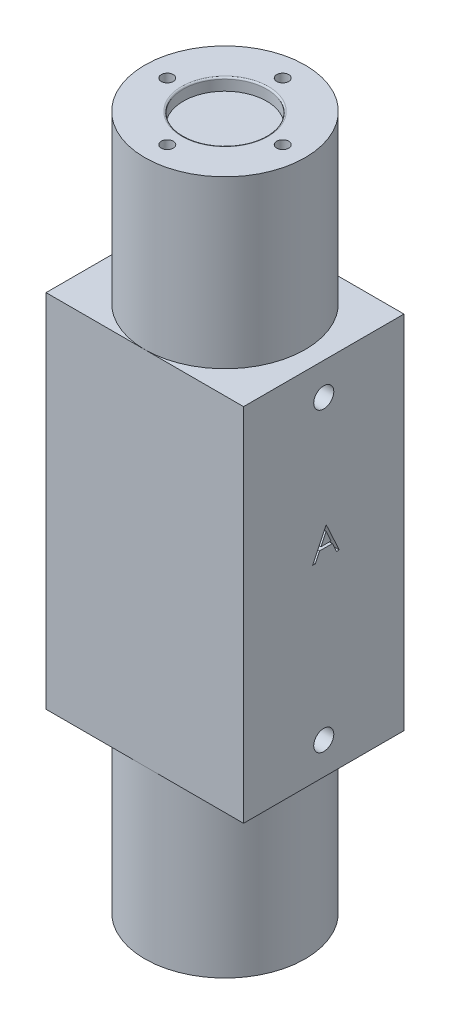
from build123d import *

# Parameters (mm, degrees)
FILLET1_R                 = 1
SKETCH2_R                 = 5.2
CUT_EXTRUDE1_DEPTH        = 1.5
FILLET2_R                 = 0.2
FILLET3_R                 = 5
CUT_EXTRUDE2_DEPTH        = 1
SKETCH6_R                 = 10
BOSS_EXTRUDE1_DEPTH       = 81.533333333
BOSS_EXTRUDE2_START       = 15.73
SKETCH8_W                 = 12.313661757
SKETCH8_H                 = 20
BOSS_EXTRUDE2_DEPTH       = 45
CUT_EXTRUDE5_DEPTH        = 2
CUT_EXTRUDE6_DEPTH        = 2
CUT_EXTRUDE_THIN1_START   = -10
SKETCH14_R                = 40
SKETCH14_R_2              = 10
CUT_EXTRUDE_THIN1_DEPTH   = 10
F_2_5MM_DOWEL_HOLE1_D     = 2.5
F_1_5MM_DOWEL_HOLE1_D     = 1.5
F_1_5MM_DOWEL_HOLE1_DEPTH = 12
F_1_5MM_DOWEL_HOLE1_TIP   = 0.450645464


with BuildPart() as part:
    # Sketch1 → Revolve1 (revolve)
    with BuildSketch(Plane(origin=(0, 0, 0), x_dir=(0, 0, -1), z_dir=(1, 0, 0))):
        Polygon((0, 0), (-30, 0), (-30, 7), (-20.102542457, 7), (-10.55, 7), (-10.55, 5), (0, 5), align=None)
    revolve(axis=Axis((0, 5, 0), (0, -1, 0)))

    # Fillet1
    fillet1_edges = [part.edges().sort_by_distance(p)[0] for p in [
        (0, 7, -10.55),
    ]]
    fillet(fillet1_edges, radius=FILLET1_R)

    # Sketch2 → Cut-Extrude1 (cut)
    with BuildSketch(Plane(origin=(0, 5, 0), x_dir=(1, 0, 0), z_dir=(0, 1, 0))):
        Circle(SKETCH2_R)
    extrude(amount=-CUT_EXTRUDE1_DEPTH, mode=Mode.SUBTRACT)

    # Fillet2
    fillet2_edges = [part.edges().sort_by_distance(p)[0] for p in [
        (-5.2, 5, 0),
    ]]
    fillet(fillet2_edges, radius=FILLET2_R)

    # Fillet3
    fillet3_edges = [part.edges().sort_by_distance(p)[0] for p in [
        (0, 7, -30),
    ]]
    fillet(fillet3_edges, radius=FILLET3_R)

    # Sketch4 → Cut-Extrude2 (cut)
    # profile 1 of 4: a face of its own
    with BuildSketch(Plane.XZ):
        Polygon((-0.644909543, 25.480704332), (0.002225874, 25.480704332), (0.002225874, 21.980704332), (-0.31187669, 21.980704332), (-0.31187669, 25.121729973), (-0.850338229, 25.121729973), align=None)
    # profile 2 of 4: a face of its own
    with BuildSketch(Plane.XZ):
        with BuildLine():
            Line((25.523815675, 2.292498481), (25.209713111, 2.292498481))
            add(Edge.make_bspline(
                [(25.209713111, 2.292498481), (25.211760264, 2.334169369), (25.215780818, 2.416009884), (25.234609107, 2.53533379), (25.261549984, 2.649388589), (25.299641438, 2.757258503), (25.346947716, 2.85989731), (25.403677743, 2.956897326), (25.470871594, 3.047888515), (25.547078328, 3.132027358), (25.629846967, 3.209214929), (25.719152906, 3.275870171), (25.812997934, 3.332187843), (25.911097333, 3.379269085), (26.014557896, 3.414608931), (26.122440754, 3.44083057), (26.23521989, 3.456606916), (26.312059912, 3.458302702), (26.351139393, 3.459165148)],
                knots=[0, 0, 0, 0, 1.10065271, 2.161652631, 3.183658789, 4.190468796, 5.17591951, 6.163126047, 7.15150782, 8.156236427, 9.156009102, 10.134482811, 11.092018607, 12.041330605, 13.001268258, 13.972401359, 14.968799086, 16, 16, 16, 16], degree=3))
            add(Edge.make_bspline(
                [(26.351139393, 3.459165148), (26.389517467, 3.458266692), (26.464929011, 3.456501257), (26.574991026, 3.441340228), (26.67976832, 3.417594636), (26.779056087, 3.38427922), (26.872062151, 3.339494792), (26.959485196, 3.285697254), (27.042366007, 3.223477422), (27.11697279, 3.150223609), (27.18548087, 3.072021224), (27.244583125, 2.988533321), (27.295196288, 2.902304035), (27.337383968, 2.812675833), (27.368440107, 2.718804805), (27.392018315, 2.622057602), (27.405345729, 2.521432791), (27.407391152, 2.453326236), (27.408431059, 2.418700405)],
                knots=[0, 0, 0, 0, 1.111607364, 2.184268762, 3.212621178, 4.221274766, 5.211760367, 6.196651075, 7.1921475, 8.207485113, 9.220403448, 10.201281604, 11.166441695, 12.114753415, 13.065576456, 14.026450734, 14.996634279, 16, 16, 16, 16], degree=3))
            add(Edge.make_bspline(
                [(27.408431059, 2.418700405), (27.406744414, 2.369950595), (27.403400723, 2.273306467), (27.37454502, 2.13110211), (27.329962923, 1.99319705), (27.275889894, 1.882217998), (27.221269326, 1.793241105), (27.17308953, 1.719325464), (27.115437178, 1.640499047), (27.048839764, 1.555967938), (26.974301958, 1.465473568), (26.89128729, 1.368978802), (26.7991616, 1.267508497), (26.734503418, 1.198202684), (26.700999168, 1.162290148)],
                knots=[0, 0, 0, 0, 1.184203166, 2.347625244, 3.513805382, 4.700623107, 5.337941753, 6.051866363, 6.845199593, 7.711357327, 8.668078039, 9.695487809, 10.805859518, 12, 12, 12, 12], degree=3))
            Line((26.700999168, 1.162290148), (25.825298046, 0.228395917))
            Line((25.825298046, 0.228395917), (27.453302854, 0.228395917))
            Line((27.453302854, 0.228395917), (27.453302854, -0.130578442))
            Line((27.453302854, -0.130578442), (25.075097726, -0.130578442))
            Line((25.075097726, -0.130578442), (26.432469521, 1.317939187))
            add(Edge.make_bspline(
                [(26.432469521, 1.317939187), (26.465517408, 1.352437493), (26.528995635, 1.41870168), (26.618778212, 1.51544464), (26.6994172, 1.605194181), (26.771434593, 1.687780729), (26.833268098, 1.764412297), (26.88814033, 1.832607), (26.932105921, 1.895361451), (26.979821317, 1.968102065), (27.026035298, 2.056914382), (27.065747654, 2.165448071), (27.089962502, 2.277175324), (27.092867338, 2.352677361), (27.094328495, 2.390655533)],
                knots=[0, 0, 0, 0, 1.329631726, 2.553950428, 3.673215718, 4.687767853, 5.603093632, 6.413772471, 7.123043292, 7.734684054, 8.834405432, 9.900288307, 10.943827018, 12, 12, 12, 12], degree=3))
            add(Edge.make_bspline(
                [(27.094328495, 2.390655533), (27.093692753, 2.414536931), (27.092439827, 2.461602582), (27.081382129, 2.530608341), (27.064671623, 2.597173154), (27.040726365, 2.661501774), (27.009119625, 2.722947426), (26.970646245, 2.781584906), (26.926256182, 2.838273871), (26.874904912, 2.891427169), (26.818493393, 2.940108375), (26.758899143, 2.98323246), (26.695849039, 3.019271571), (26.629608917, 3.048815068), (26.560363447, 3.071990449), (26.487978702, 3.088049029), (26.412654686, 3.098131512), (26.36122119, 3.099495684), (26.335013591, 3.100190789)],
                knots=[0, 0, 0, 0, 0.991446411, 1.95395049, 2.89581595, 3.838931463, 4.798493298, 5.75982156, 6.748411868, 7.785213223, 8.824556874, 9.840280684, 10.836137867, 11.835679398, 12.848801643, 13.863922112, 14.911575587, 16, 16, 16, 16], degree=3))
            add(Edge.make_bspline(
                [(26.335013591, 3.100190789), (26.307642759, 3.099475757), (26.253890962, 3.098071552), (26.174971929, 3.088248888), (26.099686152, 3.071303047), (26.027844249, 3.048126373), (25.959324663, 3.018667824), (25.894460619, 2.981976079), (25.83339773, 2.938192586), (25.776021206, 2.88855203), (25.723157227, 2.833284429), (25.676710352, 2.771674466), (25.636126337, 2.70484705), (25.600717104, 2.6329825), (25.571961414, 2.55542872), (25.549988263, 2.472461015), (25.532601417, 2.384439633), (25.526792896, 2.323654549), (25.523815675, 2.292498481)],
                knots=[0, 0, 0, 0, 1.031018746, 2.02475058, 2.990194455, 3.934040569, 4.864654155, 5.795059489, 6.735614925, 7.690564532, 8.649604399, 9.611025574, 10.590972636, 11.591080095, 12.624614302, 13.701020113, 14.821632451, 16, 16, 16, 16], degree=3))
        make_face()
    # profile 3 of 4: a face of its own
    with BuildSketch(Plane.XZ):
        with BuildLine():
            Line((0.191598009, -25.382057247), (-0.122504556, -25.382057247))
            add(Edge.make_bspline(
                [(-0.122504556, -25.382057247), (-0.113995005, -25.346824763), (-0.097359529, -25.277948138), (-0.062661956, -25.179540878), (-0.024862701, -25.086417356), (0.020526404, -25.000321283), (0.070035158, -24.91952238), (0.12675788, -24.845853255), (0.188077602, -24.77744029), (0.255902552, -24.716727052), (0.327031213, -24.661749323), (0.402465833, -24.614874266), (0.480688727, -24.574550113), (0.56224186, -24.541329881), (0.647368031, -24.516304357), (0.735297655, -24.498147552), (0.826261155, -24.486356438), (0.888008745, -24.485205674), (0.919362432, -24.484621349)],
                knots=[0, 0, 0, 0, 1.162005537, 2.271625781, 3.343758855, 4.383309926, 5.390229558, 6.379919256, 7.361854164, 8.333198761, 9.295911338, 10.242430842, 11.177959212, 12.116337295, 13.062827104, 14.020064771, 14.994644689, 16, 16, 16, 16], degree=3))
            add(Edge.make_bspline(
                [(0.919362432, -24.484621349), (0.965045174, -24.48600058), (1.055414185, -24.488728955), (1.188177232, -24.513643392), (1.316204051, -24.553068524), (1.438093299, -24.607542251), (1.551311731, -24.674729564), (1.652047918, -24.754694301), (1.738936429, -24.845893603), (1.811830806, -24.946626167), (1.868905805, -25.054281676), (1.910992179, -25.165081833), (1.93661386, -25.278763805), (1.939934417, -25.355521084), (1.941598009, -25.393976317)],
                knots=[0, 0, 0, 0, 1.083050992, 2.142477498, 3.193116406, 4.255571735, 5.30263384, 6.308962982, 7.297363603, 8.282367274, 9.249857812, 10.179914175, 11.08814088, 12, 12, 12, 12], degree=3))
            add(Edge.make_bspline(
                [(1.941598009, -25.393976317), (1.940434418, -25.430983112), (1.93815745, -25.503399667), (1.918823745, -25.609121164), (1.886287482, -25.708762764), (1.841217719, -25.802743926), (1.782876169, -25.890468766), (1.712203472, -25.972134657), (1.628700811, -26.048103815), (1.565421872, -26.091623288), (1.532844002, -26.114028401)],
                knots=[0, 0, 0, 0, 1.024540389, 2.004866551, 2.965041327, 3.920577974, 4.882998113, 5.874504559, 6.905732034, 8, 8, 8, 8], degree=3))
            add(Edge.make_bspline(
                [(1.532844002, -26.114028401), (1.570075757, -26.132006572), (1.643842631, -26.16762653), (1.744393161, -26.237482287), (1.835671036, -26.318138635), (1.886574755, -26.381081288), (1.912150893, -26.412706285)],
                knots=[0, 0, 0, 0, 1.015518401, 2.012035669, 3.001164323, 4, 4, 4, 4], degree=3))
            add(Edge.make_bspline(
                [(1.912150893, -26.412706285), (1.928992236, -26.435764037), (1.962399132, -26.481501953), (2.003634665, -26.555038379), (2.04104378, -26.629389869), (2.070193999, -26.706549275), (2.092767866, -26.785622288), (2.108903898, -26.866744684), (2.118928039, -26.949982707), (2.120363591, -27.006295187), (2.121085188, -27.034601317)],
                knots=[0, 0, 0, 0, 1.025084078, 2.033381695, 3.024893161, 4.013698104, 4.991890475, 5.976764909, 6.982997093, 8, 8, 8, 8], degree=3))
            add(Edge.make_bspline(
                [(2.121085188, -27.034601317), (2.119290675, -27.083611039), (2.115710093, -27.18139984), (2.083706018, -27.325874562), (2.034092778, -27.467100064), (1.963635842, -27.602174904), (1.877768333, -27.728555285), (1.775611009, -27.841631594), (1.6583246, -27.938830198), (1.527518951, -28.020040426), (1.385801823, -28.084958348), (1.234226231, -28.130015791), (1.074976177, -28.159361791), (0.965768879, -28.16250866), (0.910247848, -28.164108529)],
                knots=[0, 0, 0, 0, 0.955779014, 1.907060117, 2.875433937, 3.871313158, 4.872415639, 5.851225146, 6.836215519, 7.83643374, 8.849228613, 9.86973379, 10.916971861, 12, 12, 12, 12], degree=3))
            add(Edge.make_bspline(
                [(0.910247848, -28.164108529), (0.872828548, -28.163240316), (0.799199843, -28.161531961), (0.690956345, -28.14985336), (0.587634645, -28.128523355), (0.489095047, -28.09982005), (0.395250011, -28.063428308), (0.306385906, -28.01810961), (0.221956012, -27.964798108), (0.142757061, -27.90286452), (0.068798493, -27.83358318), (0.002045769, -27.75572417), (-0.058614024, -27.670726766), (-0.111556662, -27.57760371), (-0.159193615, -27.477558453), (-0.198374572, -27.369309954), (-0.23286014, -27.253825932), (-0.248893605, -27.173348192), (-0.25711994, -27.132057247)],
                knots=[0, 0, 0, 0, 1.048658725, 2.063410685, 3.046034179, 4.001477787, 4.936774919, 5.862367409, 6.792675028, 7.730719943, 8.675894397, 9.627829632, 10.600096036, 11.597688215, 12.626045268, 13.701542398, 14.82072376, 16, 16, 16, 16], degree=3))
            Line((-0.25711994, -27.132057247), (0.056982624, -27.132057247))
            add(Edge.make_bspline(
                [(0.056982624, -27.132057247), (0.065165915, -27.15900626), (0.081083128, -27.211424432), (0.108177426, -27.286864737), (0.139045698, -27.356022791), (0.172160257, -27.419405913), (0.206938703, -27.477638315), (0.245853628, -27.529180184), (0.286022773, -27.576295386), (0.316302126, -27.602839998), (0.331121246, -27.615831285)],
                knots=[0, 0, 0, 0, 1.198163088, 2.33053128, 3.407730985, 4.417276592, 5.372219308, 6.28897303, 7.162600585, 8, 8, 8, 8], degree=3))
            add(Edge.make_bspline(
                [(0.331121246, -27.615831285), (0.350717822, -27.630939619), (0.389850485, -27.661109651), (0.453618716, -27.69961128), (0.520683602, -27.732972305), (0.592498277, -27.758456001), (0.667513047, -27.780033661), (0.746940412, -27.79415418), (0.830079629, -27.803842352), (0.886847393, -27.804697283), (0.915856823, -27.80513417)],
                knots=[0, 0, 0, 0, 0.946170439, 1.889420265, 2.845303464, 3.807233317, 4.801018734, 5.828864929, 6.890507805, 8, 8, 8, 8], degree=3))
            add(Edge.make_bspline(
                [(0.915856823, -27.80513417), (0.948610325, -27.804518265), (1.012656972, -27.803313915), (1.106111832, -27.792238208), (1.195019279, -27.776107795), (1.278392205, -27.751194812), (1.357322712, -27.720413961), (1.430704362, -27.681765555), (1.499500468, -27.636420833), (1.562829874, -27.584881675), (1.619775381, -27.52846018), (1.669914894, -27.469447109), (1.712539556, -27.408091279), (1.746923134, -27.344053158), (1.774073684, -27.277597929), (1.792556885, -27.2085391), (1.8054084, -27.137441834), (1.806455012, -27.089112865), (1.806982624, -27.064749555)],
                knots=[0, 0, 0, 0, 1.217147791, 2.380027433, 3.494444702, 4.572153297, 5.609568379, 6.639424714, 7.649109417, 8.668170816, 9.669597737, 10.625200337, 11.543417969, 12.441394052, 13.322311151, 14.205496177, 15.095365482, 16, 16, 16, 16], degree=3))
            add(Edge.make_bspline(
                [(1.806982624, -27.064749555), (1.805452322, -27.032138216), (1.802399334, -26.967077807), (1.779090755, -26.871360233), (1.74075189, -26.779136821), (1.687079379, -26.691981031), (1.62174365, -26.611205129), (1.545378744, -26.539133647), (1.457350515, -26.479663556), (1.376330646, -26.438574899), (1.30456549, -26.410537824), (1.243150105, -26.39186286), (1.174393502, -26.376049204), (1.099127153, -26.361336932), (1.016783936, -26.348815584), (0.927453498, -26.338373768), (0.831117737, -26.330018727), (0.764426571, -26.326287632), (0.730059547, -26.324364939)],
                knots=[0, 0, 0, 0, 1.07054697, 2.135767047, 3.216561865, 4.33974944, 5.486079747, 6.621378074, 7.775625952, 8.963672916, 9.598146892, 10.304877434, 11.070270905, 11.915000392, 12.823868403, 13.805723172, 14.86925407, 16, 16, 16, 16], degree=3))
            Line((0.730059547, -26.324364939), (0.730059547, -25.96539058))
            add(Edge.make_bspline(
                [(0.730059547, -25.96539058), (0.773360713, -25.964655776), (0.858177059, -25.963216476), (0.982071364, -25.945808466), (1.100544676, -25.921727838), (1.210971418, -25.884842646), (1.311620132, -25.842002349), (1.398939734, -25.792150139), (1.471706881, -25.73673539), (1.529567952, -25.674902781), (1.573097181, -25.608587733), (1.604923979, -25.539471076), (1.623724305, -25.466947015), (1.626233972, -25.417452347), (1.627495444, -25.392574074)],
                knots=[0, 0, 0, 0, 1.321986639, 2.589447074, 3.816329219, 5.01088745, 6.139805852, 7.153945165, 8.075214402, 8.924034688, 9.728124013, 10.488707548, 11.240355623, 12, 12, 12, 12], degree=3))
            add(Edge.make_bspline(
                [(1.627495444, -25.392574074), (1.627081034, -25.374296329), (1.626256583, -25.337933622), (1.615859305, -25.284808553), (1.600235264, -25.233307607), (1.578755535, -25.183649797), (1.550005336, -25.136179523), (1.515599349, -25.090492074), (1.474631249, -25.046848295), (1.427685802, -25.006167975), (1.377273997, -24.967398738), (1.322024222, -24.934485101), (1.263602347, -24.906340039), (1.201943692, -24.883130537), (1.136848162, -24.865671249), (1.068621604, -24.853135407), (0.997133921, -24.845297753), (0.948362189, -24.844169337), (0.923569162, -24.843595708)],
                knots=[0, 0, 0, 0, 0.884392785, 1.759457502, 2.611959086, 3.489218968, 4.37281399, 5.2945488, 6.255912374, 7.266815255, 8.301784654, 9.332968512, 10.37626691, 11.440494194, 12.520033166, 13.637162961, 14.798855837, 16, 16, 16, 16], degree=3))
            add(Edge.make_bspline(
                [(0.923569162, -24.843595708), (0.883717494, -24.84498707), (0.805877918, -24.847704724), (0.693663001, -24.871507737), (0.589343667, -24.909485821), (0.509605001, -24.95481884), (0.450722426, -24.999569274), (0.408645488, -25.038651661), (0.367324978, -25.082084484), (0.329479301, -25.13254286), (0.291205324, -25.18660965), (0.256360763, -25.247033331), (0.22250107, -25.312237726), (0.202098521, -25.35833336), (0.191598009, -25.382057247)],
                knots=[0, 0, 0, 0, 1.472543308, 2.876219568, 4.221790263, 5.565193594, 6.249813518, 6.953379497, 7.687249741, 8.463570142, 9.283606569, 10.136032583, 11.040678096, 12, 12, 12, 12], degree=3))
        make_face()
    # profile 4 of 4: a face of its own
    with BuildSketch(Plane.XZ):
        Polygon((-24.84722085, 3.262784403), (-24.783418767, 3.262784403), (-24.783418767, 0.83970748), (-24.379572613, 0.83970748), (-24.379572613, 0.480733121), (-24.783418767, 0.480733121), (-24.783418767, -0.326959187), (-25.097521331, -0.326959187), (-25.097521331, 0.480733121), (-26.757777741, 0.480733121), align=None)
        Polygon((-25.097521331, 0.83970748), (-25.097521331, 2.358337287), (-26.14008944, 0.83970748), align=None, mode=Mode.SUBTRACT)
    extrude(amount=-CUT_EXTRUDE2_DEPTH, mode=Mode.SUBTRACT)

    # Sketch6 → Boss-Extrude1 (add)
    with BuildSketch(Plane.XZ):
        Circle(SKETCH6_R)
    extrude(amount=BOSS_EXTRUDE1_DEPTH)

    # Sketch8 → Boss-Extrude2 (add)
    with BuildSketch(Plane(origin=(0, 0, 0), x_dir=(-1, 0, 0), z_dir=(0, -1, 0)).offset(BOSS_EXTRUDE2_START)):
        with Locations((-6.156830879, 0)):
            Rectangle(SKETCH8_W, SKETCH8_H)
        with BuildLine():
            Line((12.313661757, 10), (0, 10))
            ThreePointArc((0, 10), (10, 0), (0, -10))
            Line((0, -10), (12.313661757, -10))
            Line((12.313661757, -10), (12.313661757, 10))
        make_face()
    extrude(amount=BOSS_EXTRUDE2_DEPTH)

    # Sketch12 → Cut-Extrude5 (cut)
    with BuildSketch(Plane(origin=(12.313661757, 0, 0), x_dir=(0, 0, -1), z_dir=(1, 0, 0))):
        Polygon((0.322889874, -33.675221664), (1.93827449, -37.175221664), (1.596828176, -37.175221664), (1.079400291, -36.053426792), (-0.507238331, -36.053426792), (-1.038688651, -37.175221664), (-1.382238331, -37.175221664), (0.278018079, -33.675221664), align=None)
        Polygon((0.296948368, -34.358114292), (-0.336164613, -35.694452433), (0.913935547, -35.694452433), align=None, mode=Mode.SUBTRACT)
    extrude(amount=-CUT_EXTRUDE5_DEPTH, mode=Mode.SUBTRACT)

    # Sketch13 → Cut-Extrude6 (cut)
    with BuildSketch(Plane.ZY.offset(12.313661757)):
        with BuildLine():
            Line((-0.99287483, -31.753097959), (-0.309982202, -31.753097959))
            add(Edge.make_bspline(
                [(-0.309982202, -31.753097959), (-0.276553724, -31.753273709), (-0.211761013, -31.753614357), (-0.117541571, -31.758897488), (-0.029292761, -31.766101158), (0.053011011, -31.777531251), (0.129331714, -31.791323028), (0.199899351, -31.808024844), (0.264489523, -31.828051458), (0.34160226, -31.859897739), (0.429522921, -31.907220907), (0.524721313, -31.977149472), (0.606125553, -32.062681935), (0.67631187, -32.159164591), (0.73211299, -32.265300363), (0.772482287, -32.378559551), (0.798040162, -32.497481293), (0.800668596, -32.579124471), (0.801996965, -32.620385619)],
                knots=[0, 0, 0, 0, 1.001505555, 1.941167018, 2.826882275, 3.653841531, 4.429895133, 5.150066043, 5.825578002, 6.45369114, 7.647487171, 8.808567382, 9.977351308, 11.170798116, 12.373658725, 13.556498008, 14.765093433, 16, 16, 16, 16], degree=3))
            add(Edge.make_bspline(
                [(0.801996965, -32.620385619), (0.800903746, -32.659038175), (0.798755469, -32.734994092), (0.77821271, -32.846088201), (0.746052041, -32.95183942), (0.701346792, -33.051861805), (0.643244796, -33.143895418), (0.574386477, -33.228682684), (0.491309675, -33.302633741), (0.429066435, -33.343976644), (0.397449689, -33.364976965)],
                knots=[0, 0, 0, 0, 1.044552857, 2.05264487, 3.044412934, 4.028983338, 5.005914585, 5.980388656, 6.974128949, 8, 8, 8, 8], degree=3))
            add(Edge.make_bspline(
                [(0.397449689, -33.364976965), (0.437210117, -33.380241964), (0.513281664, -33.409447688), (0.617967677, -33.461083152), (0.708162522, -33.517245263), (0.784559668, -33.578577113), (0.849897322, -33.644685924), (0.906950264, -33.716541038), (0.955631638, -33.795079796), (0.997344562, -33.879483331), (1.029893318, -33.9688898), (1.054269222, -34.062460576), (1.068236671, -34.159860131), (1.070224313, -34.22614551), (1.071227734, -34.259608375)],
                knots=[0, 0, 0, 0, 1.27268992, 2.434971085, 3.483601985, 4.442670788, 5.356604649, 6.2567628, 7.179492994, 8.113709626, 9.066344395, 10.018646069, 10.999752585, 12, 12, 12, 12], degree=3))
            add(Edge.make_bspline(
                [(1.071227734, -34.259608375), (1.070250888, -34.293775247), (1.068328916, -34.360999526), (1.054148944, -34.45975466), (1.030139837, -34.554129607), (0.997068691, -34.644734789), (0.953906376, -34.731394924), (0.901378412, -34.814208188), (0.838746848, -34.892342518), (0.768683979, -34.966666142), (0.689421834, -35.033493929), (0.603906079, -35.093009636), (0.511059759, -35.141955698), (0.412407765, -35.183071719), (0.306843449, -35.214478918), (0.194840842, -35.236451492), (0.07649654, -35.251256529), (-0.004713211, -35.252473733), (-0.046360407, -35.253097959)],
                knots=[0, 0, 0, 0, 0.978564426, 1.925352924, 2.850884081, 3.763762016, 4.682927383, 5.618979971, 6.567305752, 7.547517671, 8.540179244, 9.531824382, 10.526200242, 11.540722885, 12.589160233, 13.674978461, 14.80764778, 16, 16, 16, 16], degree=3))
            Line((-0.046360407, -35.253097959), (-0.99287483, -35.253097959))
            Line((-0.99287483, -35.253097959), (-0.99287483, -31.753097959))
        make_face()
        with BuildLine():
            Line((-0.678772266, -32.112072318), (-0.678772266, -33.233867189))
            Line((-0.678772266, -33.233867189), (-0.467734606, -33.233867189))
            add(Edge.make_bspline(
                [(-0.467734606, -33.233867189), (-0.43688581, -33.233467266), (-0.377279651, -33.232694534), (-0.290959755, -33.230481017), (-0.210834736, -33.224282973), (-0.137042903, -33.218086711), (-0.069700459, -33.208012123), (-0.008956598, -33.196020001), (0.046141999, -33.183337095), (0.109681545, -33.161767609), (0.181754493, -33.129889933), (0.258587597, -33.080418097), (0.326322067, -33.021493744), (0.383519255, -32.953502782), (0.430330725, -32.878636596), (0.46284444, -32.798089716), (0.484891724, -32.713869584), (0.486883256, -32.656051331), (0.487894401, -32.626695715)],
                knots=[0, 0, 0, 0, 1.156816544, 2.235205308, 3.236616184, 4.169592532, 5.011045266, 5.787822928, 6.49130361, 7.128639758, 8.301311294, 9.436451833, 10.541879658, 11.654887649, 12.756523258, 13.837046038, 14.901820046, 16, 16, 16, 16], degree=3))
            add(Edge.make_bspline(
                [(0.487894401, -32.626695715), (0.487368221, -32.607269944), (0.486336061, -32.569164171), (0.477882758, -32.513614817), (0.463515184, -32.461371065), (0.44506089, -32.411716954), (0.419272202, -32.366205104), (0.388908738, -32.323261909), (0.352223048, -32.28434979), (0.310465735, -32.247980292), (0.262457113, -32.215735764), (0.208225821, -32.187495001), (0.147038144, -32.164754224), (0.079925289, -32.144838072), (0.005854201, -32.130849778), (-0.074320352, -32.11919639), (-0.161255071, -32.113263648), (-0.221400174, -32.112478285), (-0.252490215, -32.112072318)],
                knots=[0, 0, 0, 0, 0.91205012, 1.789085906, 2.630437955, 3.453916878, 4.269457761, 5.079663411, 5.91843418, 6.774407191, 7.675494373, 8.627863946, 9.638891023, 10.736472738, 11.911756761, 13.175263542, 14.539845004, 16, 16, 16, 16], degree=3))
            Line((-0.252490215, -32.112072318), (-0.678772266, -32.112072318))
        make_face(mode=Mode.SUBTRACT)
        with BuildLine():
            Line((-0.678772266, -33.592841548), (-0.678772266, -34.8941236))
            Line((-0.678772266, -34.8941236), (-0.231456561, -34.8941236))
            add(Edge.make_bspline(
                [(-0.231456561, -34.8941236), (-0.199437635, -34.893739852), (-0.137725376, -34.89300023), (-0.048624146, -34.890585675), (0.033958958, -34.885093399), (0.109647093, -34.87644755), (0.179257546, -34.867069101), (0.241955249, -34.85445782), (0.298248442, -34.840008859), (0.36352275, -34.817674687), (0.437026258, -34.782978216), (0.516237115, -34.73066399), (0.586663333, -34.668340682), (0.646468592, -34.596209768), (0.695481581, -34.517778441), (0.731137036, -34.434633091), (0.753127893, -34.348147563), (0.755790062, -34.289180851), (0.75712517, -34.259608375)],
                knots=[0, 0, 0, 0, 1.160039823, 2.235823828, 3.228722157, 4.157150951, 4.99529583, 5.772374946, 6.472645482, 7.099169577, 8.269452708, 9.405989375, 10.527446681, 11.663510218, 12.788923519, 13.866172445, 14.929861265, 16, 16, 16, 16], degree=3))
            add(Edge.make_bspline(
                [(0.75712517, -34.259608375), (0.756849066, -34.241115035), (0.756301311, -34.204426653), (0.748040696, -34.150510834), (0.736026826, -34.098284961), (0.720495392, -34.04760722), (0.697875925, -33.999393844), (0.67146938, -33.952691284), (0.640507978, -33.907437805), (0.592263812, -33.850225551), (0.522091828, -33.784308538), (0.422385052, -33.719771036), (0.309012754, -33.667723229), (0.226785261, -33.645623753), (0.184308664, -33.634207734)],
                knots=[0, 0, 0, 0, 0.723448775, 1.435228256, 2.130040452, 2.821711965, 3.505591119, 4.210454504, 4.921174351, 5.648778258, 7.137944449, 8.670945889, 10.280296675, 12, 12, 12, 12], degree=3))
            add(Edge.make_bspline(
                [(0.184308664, -33.634207734), (0.167279568, -33.63075265), (0.130356975, -33.623261316), (0.070149395, -33.615353612), (0.001413526, -33.608308552), (-0.076009351, -33.603097395), (-0.162217192, -33.597710851), (-0.257394111, -33.59561603), (-0.361151426, -33.59311677), (-0.433143798, -33.592935636), (-0.470539093, -33.592841548)],
                knots=[0, 0, 0, 0, 0.634451884, 1.375622551, 2.216452059, 3.157844607, 4.20941857, 5.370758133, 6.634282058, 8, 8, 8, 8], degree=3))
            Line((-0.470539093, -33.592841548), (-0.678772266, -33.592841548))
        make_face(mode=Mode.SUBTRACT)
    extrude(amount=-CUT_EXTRUDE6_DEPTH, mode=Mode.SUBTRACT)

    # Sketch14 → Cut-Extrude-Thin1 (cut)
    with BuildSketch(Plane.XZ.offset(CUT_EXTRUDE_THIN1_START)):
        Circle(SKETCH14_R)
        Circle(SKETCH14_R_2, mode=Mode.SUBTRACT)
    extrude(amount=CUT_EXTRUDE_THIN1_DEPTH, mode=Mode.SUBTRACT)

    # Ø2.5mm Dowel Hole1 (through all)
    with Locations(Plane.ZY.offset(12.313661757)):
        with Locations((0, -19.73), (0, -56.73)):
            Hole(F_2_5MM_DOWEL_HOLE1_D / 2)

    # Ø1.5mm Dowel Hole1
    with Locations(Plane(origin=(0, 5, 0), x_dir=(1, 0, 0), z_dir=(0, 1, 0))):
        with Locations((-7.2, 0), (0, 7.2), (7.2, 0), (0, -7.2)):
            Hole(F_1_5MM_DOWEL_HOLE1_D / 2, depth=F_1_5MM_DOWEL_HOLE1_DEPTH)
            with Locations((0, 0, -(F_1_5MM_DOWEL_HOLE1_DEPTH + F_1_5MM_DOWEL_HOLE1_TIP / 2))):  # 118° drill point
                Cone(0, F_1_5MM_DOWEL_HOLE1_D / 2, F_1_5MM_DOWEL_HOLE1_TIP, mode=Mode.SUBTRACT)


solid = part.part
